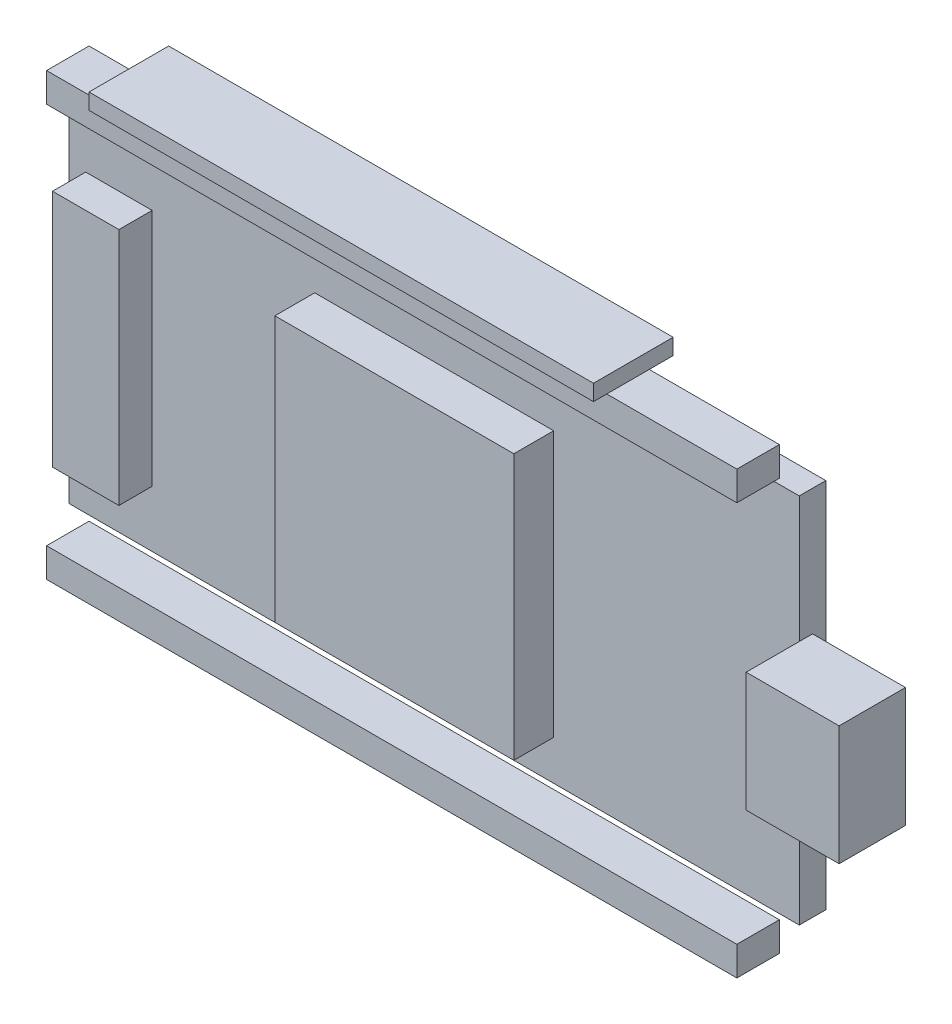
from build123d import *

# Parameters (mm, degrees)
ESP32_START                              = -1
SKETCH_1_W                               = 55
SKETCH_1_H                               = 28
ESP32_DEVKIT_PCB_APPROX_55_X_28_MM_DEPTH = 2
ESP_WROOM_START                          = 2
SKETCH_2_W                               = 18
SKETCH_2_H                               = 20
ESP_WROOM_SHIELD_CAN_DEPTH               = 3
SKETCH_3_W                               = 7
SKETCH_3_H                               = 9
MICRO_USB_CONNECTOR_DEPTH                = 5
RESET_START                              = 1.75
SKETCH_4_W                               = 5
SKETCH_4_H                               = 18
RESET_BOOT_BUTTON_PAIR_DEPTH             = 2.5
LEFT_START                               = 1
SKETCH_5_W                               = 52
SKETCH_5_H                               = 2.2
LEFT_PIN_HEADER_ROW_DEPTH                = 3.2
RIGHT_START                              = 1
SKETCH_6_W                               = 52
SKETCH_6_H                               = 2.2
RIGHT_PIN_HEADER_ROW_DEPTH               = 3.2
ESP32_START_2                            = 2
SKETCH_7_W                               = 38
SKETCH_7_H                               = 1.2
ESP32_LABEL_PLATE_ESP32_55X28_DEPTH      = 6


with BuildPart() as part:
    # 草图1 → ESP32 DevKit PCB - approx 55 x 28 mm (new body)
    with BuildSketch(Plane.XY.offset(ESP32_START)):
        Rectangle(SKETCH_1_W, SKETCH_1_H)
    extrude(amount=ESP32_DEVKIT_PCB_APPROX_55_X_28_MM_DEPTH)


with BuildPart() as body_2:
    # 草图2 → ESP-WROOM shield can (new body)
    with BuildSketch(Plane.XY.offset(ESP_WROOM_START)):
        with Locations((1, 0)):
            Rectangle(SKETCH_2_W, SKETCH_2_H)
    extrude(amount=ESP_WROOM_SHIELD_CAN_DEPTH)


with BuildPart() as body_3:
    # 草图3 → micro USB connector (new body)
    with BuildSketch(Plane.XY):
        with Locations((31, 0)):
            Rectangle(SKETCH_3_W, SKETCH_3_H)
    extrude(amount=MICRO_USB_CONNECTOR_DEPTH)


with BuildPart() as body_4:
    # 草图4 → reset / boot button pair (new body)
    with BuildSketch(Plane.XY.offset(RESET_START)):
        with Locations((-23, 0)):
            Rectangle(SKETCH_4_W, SKETCH_4_H)
    extrude(amount=RESET_BOOT_BUTTON_PAIR_DEPTH)


with BuildPart() as body_5:
    # 草图5 → left pin header row (new body)
    with BuildSketch(Plane.XY.offset(LEFT_START)):
        with Locations((0, -15.5)):
            Rectangle(SKETCH_5_W, SKETCH_5_H)
    extrude(amount=LEFT_PIN_HEADER_ROW_DEPTH)


with BuildPart() as body_6:
    # 草图6 → right pin header row (new body)
    with BuildSketch(Plane.XY.offset(RIGHT_START)):
        with Locations((0, 15.5)):
            Rectangle(SKETCH_6_W, SKETCH_6_H)
    extrude(amount=RIGHT_PIN_HEADER_ROW_DEPTH)


with BuildPart() as body_7:
    # 草图7 → esp32 label plate - ESP32 55x28 (new body)
    with BuildSketch(Plane.XY.offset(ESP32_START_2)):
        with Locations((0, 20)):
            Rectangle(SKETCH_7_W, SKETCH_7_H)
    extrude(amount=ESP32_LABEL_PLATE_ESP32_55X28_DEPTH)


solid = Compound([part.part, body_2.part, body_3.part, body_4.part, body_5.part, body_6.part, body_7.part])
